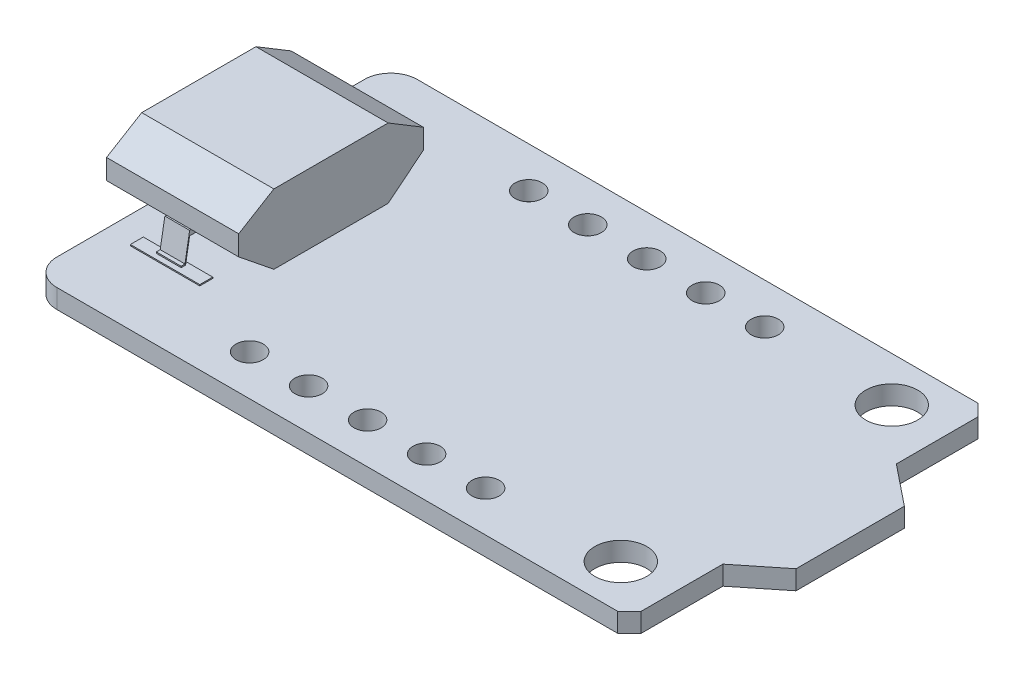
from build123d import *

# Parameters (mm, degrees)
BOSS_EXTRUDE1_DEPTH      = 0.405
FILLET1_R                = 1.12
CHAMFER1_SIZE            = 0.5
SKETCH2_R                = 1.1
CUT_EXTRUDE1_DEPTH       = 16.574075414
BOSS_EXTRUDE2_DEPTH      = 0.5
BOSS_EXTRUDE2_DEPTH_BACK = 5.1
SKETCH4_W                = 2.941717286
SKETCH4_H                = 0.549853698
BOSS_EXTRUDE3_DEPTH      = 0.05
BOSS_EXTRUDE4_DEPTH      = 0.525
SKETCH6_R                = 0.577649515
CUT_EXTRUDE2_DEPTH       = 17.26947218


with BuildPart() as part:
    # Sketch1 → Boss-Extrude1 (new, symmetric)
    with BuildSketch(Plane(origin=(0, 0, 0), x_dir=(1, 0, 0), z_dir=(0, 1, 0))):
        Polygon((-13.55, 7.635), (11.83, 7.635), (11.83, 3.675), (13.55, 2.295), (13.55, -2.295), (11.83, -3.675), (11.83, -7.635), (-13.55, -7.635), align=None)
    extrude(amount=BOSS_EXTRUDE1_DEPTH, both=True)

    # Fillet1
    fillet1_edges = [part.edges().sort_by_distance(p)[0] for p in [
        (-13.55, 0, -7.635),
        (-13.55, 0, 7.635),
    ]]
    fillet(fillet1_edges, radius=FILLET1_R)

    # Chamfer1
    chamfer1_edges = [part.edges().sort_by_distance(p)[0] for p in [
        (11.83, 0, -7.635),
        (11.83, 0, 7.635),
    ]]
    chamfer(chamfer1_edges, length=CHAMFER1_SIZE)

    # Sketch2 → Cut-Extrude1 (cut, through all)
    with BuildSketch(Plane(origin=(0, 0.405, 0), x_dir=(1, 0, 0), z_dir=(0, 1, 0))):
        with Locations(Location((9.57, 5.74, 0), (0, 0, 270))):
            Circle(SKETCH2_R)
        with Locations(Location((9.57, -5.74, 0), (0, 0, 270))):
            Circle(SKETCH2_R)
    extrude(amount=-CUT_EXTRUDE1_DEPTH, mode=Mode.SUBTRACT)

    # Sketch4 → Boss-Extrude3 (add)
    with BuildSketch(Plane(origin=(0, 0.405, 0), x_dir=(1, 0, 0), z_dir=(0, 1, 0))):
        with Locations((-10.930908088, 4.275112504)):
            Rectangle(SKETCH4_W, SKETCH4_H)
        with Locations((-10.930908088, -4.275112504)):
            Rectangle(SKETCH4_W, SKETCH4_H)
    extrude(amount=BOSS_EXTRUDE3_DEPTH)



with BuildPart() as body_2:
    # Sketch3 → Boss-Extrude2 (new, two sides: drawn at the far end of the back side and taken through both)
    with BuildSketch(Plane.ZY.offset(13.55).offset(-BOSS_EXTRUDE2_DEPTH_BACK)):
        Polygon((-3.91, 1.655), (-2.42, 0.455), (2.42, 0.455), (3.91, 1.655), (3.91, 2.505), (2.42, 3.405), (-2.42, 3.405), (-3.91, 2.505), align=None)
    extrude(amount=BOSS_EXTRUDE2_DEPTH + BOSS_EXTRUDE2_DEPTH_BACK)


with BuildPart() as part_1:
    add(part.part)

    add(body_2.part)  # Boss-Extrude4 merges body 2
    # Sketch5 → Boss-Extrude4 (add, symmetric)
    with BuildSketch(Plane(origin=(-11, 0, 0), x_dir=(0, 0, -1), z_dir=(1, 0, 0))):
        Polygon((4.325381098, 0.455), (4.325381098, 0.509426612), (4.162105788, 0.509426612), (3.964358919, 1.644096311), (3.498388432, 1.644096311), (3.498388432, 1.44259556), (3.964358919, 1.44259556), (4.136474144, 0.455), align=None)
        Polygon((-4.136474144, 0.455), (-4.325381098, 0.455), (-4.325381098, 0.509426612), (-4.162105788, 0.509426612), (-3.964358919, 1.644096311), (-3.498388432, 1.644096311), (-3.498388432, 1.44259556), (-3.964358919, 1.44259556), align=None)
    extrude(amount=BOSS_EXTRUDE4_DEPTH, both=True)

    # Sketch6 → Cut-Extrude2 (cut, through all)
    with BuildSketch(Plane(origin=(0, 0.405, 0), x_dir=(1, 0, 0), z_dir=(0, 1, 0))):
        with Locations(Location((-5.985172419, 5.913658107, 0), (0, 0, 270))):
            Circle(SKETCH6_R)
        with Locations(Location((-3.485172419, 5.913658107, 0), (0, 0, 270))):
            Circle(SKETCH6_R)
        with Locations(Location((-0.985172419, 5.913658107, 0), (0, 0, 270))):
            Circle(SKETCH6_R)
        with Locations(Location((1.514827581, 5.913658107, 0), (0, 0, 270))):
            Circle(SKETCH6_R)
        with Locations(Location((4.014827581, 5.913658107, 0), (0, 0, 270))):
            Circle(SKETCH6_R)
        with Locations(Location((4.014827581, -5.913658107, 0), (0, 0, 90))):
            Circle(SKETCH6_R)
        with Locations(Location((1.514827581, -5.913658107, 0), (0, 0, 90))):
            Circle(SKETCH6_R)
        with Locations(Location((-0.985172419, -5.913658107, 0), (0, 0, 90))):
            Circle(SKETCH6_R)
        with Locations(Location((-3.485172419, -5.913658107, 0), (0, 0, 90))):
            Circle(SKETCH6_R)
        with Locations(Location((-5.985172419, -5.913658107, 0), (0, 0, 90))):
            Circle(SKETCH6_R)
    extrude(amount=-CUT_EXTRUDE2_DEPTH, mode=Mode.SUBTRACT)


solid = part_1.part
